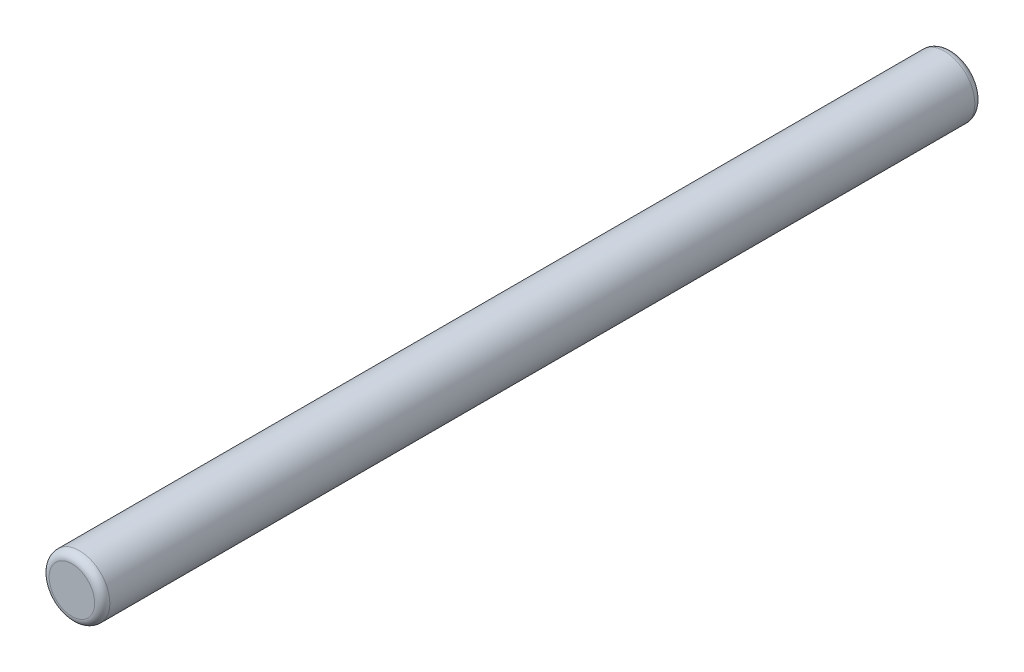
from build123d import *

# Parameters (mm, degrees)
SKETCH1_R           = 6.35
BOSS_EXTRUDE1_DEPTH = 184.15
FILLET1_R           = 1.5875


with BuildPart() as part:
    # Sketch1 → Boss-Extrude1 (new body)
    with BuildSketch(Plane.XY):
        Circle(SKETCH1_R)
    extrude(amount=BOSS_EXTRUDE1_DEPTH)

    # Fillet1
    fillet1_edges = [part.edges().sort_by_distance(p)[0] for p in [
        (-6.35, 0, 0),
        (-6.35, 0, 184.15),
    ]]
    fillet(fillet1_edges, radius=FILLET1_R)


solid = part.part
